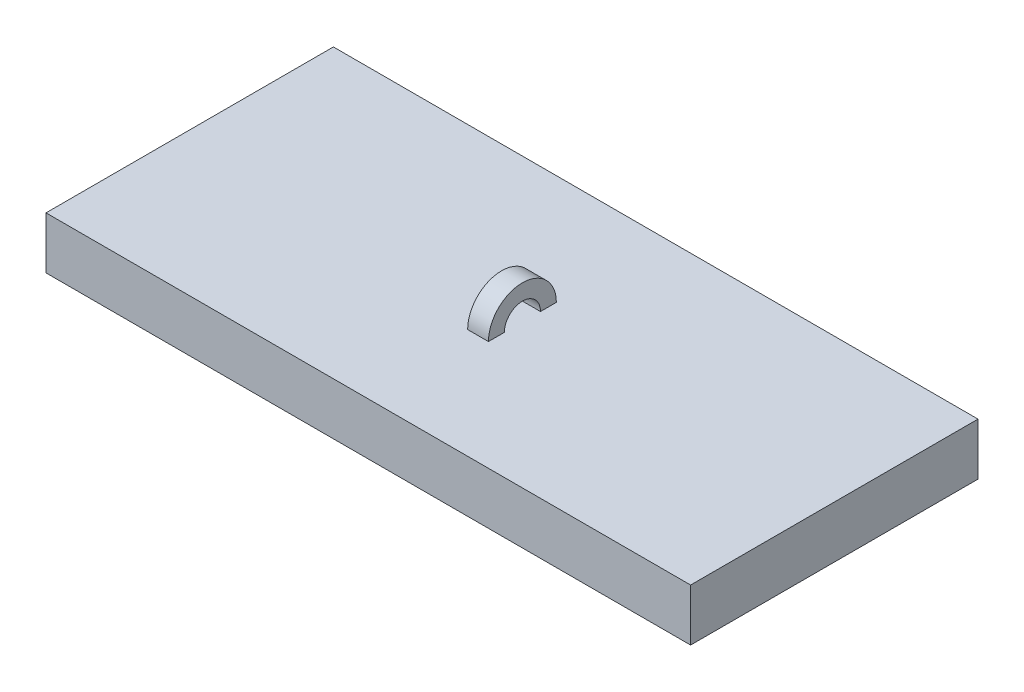
from build123d import *

# Parameters (mm, degrees)
SKETCH2_W           = 123.909820238
SKETCH2_H           = 55.24312819
BOSS_EXTRUDE2_DEPTH = 10
SKETCH3_W           = 4
SKETCH3_H           = 3.05525832
REVOLVE4_ANGLE      = 180


with BuildPart() as part:
    # Sketch2 → Boss-Extrude2 (new body)
    with BuildSketch(Plane(origin=(0, 0, 0), x_dir=(1, 0, 0), z_dir=(0, 1, 0))):
        Rectangle(SKETCH2_W, SKETCH2_H)
    extrude(amount=BOSS_EXTRUDE2_DEPTH)

    # Sketch3 → Revolve4 (revolve)
    with BuildSketch(Plane(origin=(0, 10, 0), x_dir=(1, 0, 0), z_dir=(0, 1, 0))):
        with Locations((0, 4.999513614)):
            Rectangle(SKETCH3_W, SKETCH3_H)
    revolve(axis=Axis((-61.954910119, 10, 0), (1, 0, 0)), revolution_arc=REVOLVE4_ANGLE)


solid = part.part
